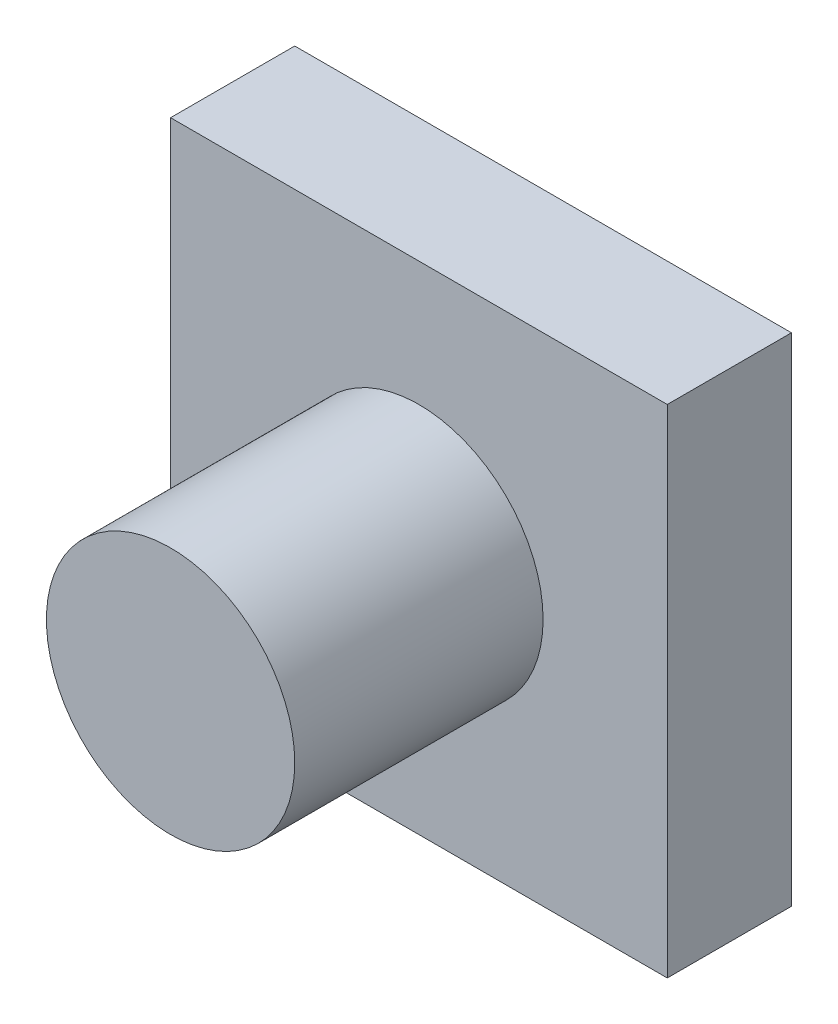
from build123d import *

# Parameters (mm, degrees)
SKETCH1_W           = 40
SKETCH1_H           = 40
BOSS_EXTRUDE1_DEPTH = 10
SKETCH2_R           = 10
BOSS_EXTRUDE2_DEPTH = 20


with BuildPart() as part:
    # Sketch1 → Boss-Extrude1 (new body)
    with BuildSketch(Plane.XY):
        Rectangle(SKETCH1_W, SKETCH1_H)
    extrude(amount=BOSS_EXTRUDE1_DEPTH)

    # Sketch2 → Boss-Extrude2 (add)
    with BuildSketch(Plane.XY.offset(10)):
        Circle(SKETCH2_R)
    extrude(amount=BOSS_EXTRUDE2_DEPTH)


solid = part.part
